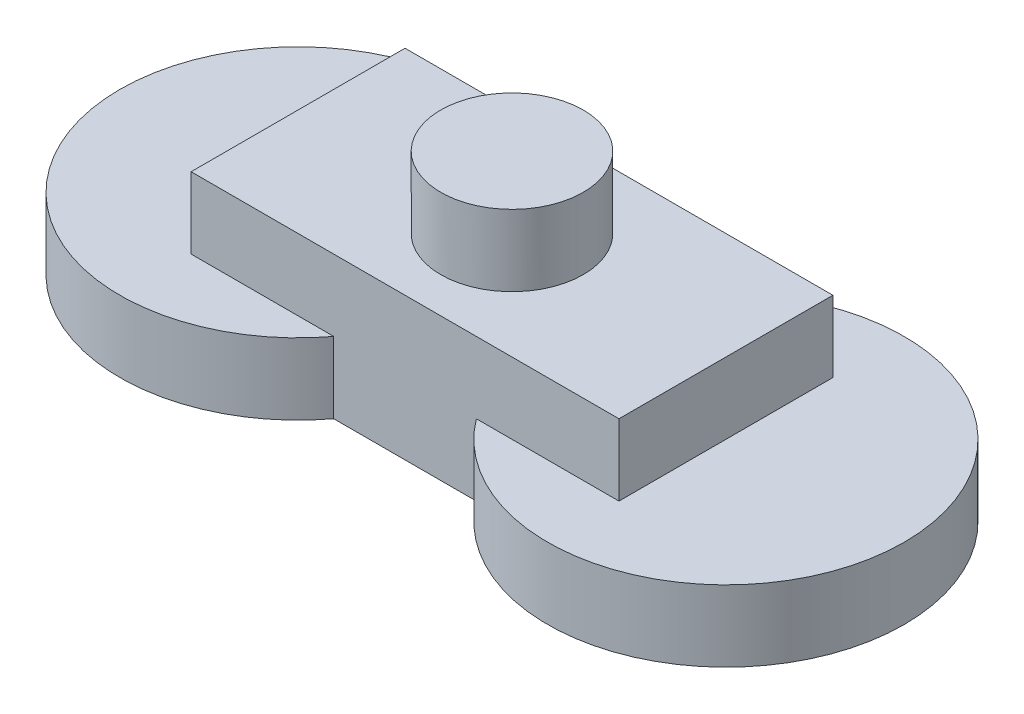
from build123d import *

# Parameters (mm, degrees)
EXTRUDE_1_DEPTH   = 10
EXTRUDE_1_2_DEPTH = 10
SKETCH_1_3_W      = 60
SKETCH_1_3_H      = 30
SKETCH_1_3_R      = 10
EXTRUDE_2_DEPTH   = 20
SKETCH_7_R        = 10
EXTRUDE_4_DEPTH   = 30


with BuildPart() as part:
    # 스케치1 → 보스-돌출1 (new body)
    with BuildSketch(Plane(origin=(0, 0, 0), x_dir=(1, 0, 0), z_dir=(0, 1, 0))):
        with BuildLine():
            Line((20.689216343, -8.628600134), (20.689216343, -38.628600134))
            Line((20.689216343, -38.628600134), (0.689216343, -38.628600134))
            ThreePointArc((0.689216343, -38.628600134), (45.689216343, -23.628600134), (0.689216343, -8.628600134))
            Line((0.689216343, -8.628600134), (20.689216343, -8.628600134))
        make_face()
    extrude(amount=EXTRUDE_1_DEPTH)



with BuildPart() as body_2:
    # 스케치1 → Extrude 1 2 (new body)
    with BuildSketch(Plane(origin=(0, 0, 0), x_dir=(1, 0, 0), z_dir=(0, 1, 0))):
        with BuildLine():
            ThreePointArc((-19.310783657, -8.628600134), (-64.310783657, -23.628600134), (-19.310783657, -38.628600134))
            Line((-19.310783657, -38.628600134), (-39.310783657, -38.628600134))
            Line((-39.310783657, -38.628600134), (-39.310783657, -8.628600134))
            Line((-39.310783657, -8.628600134), (-19.310783657, -8.628600134))
        make_face()
    extrude(amount=EXTRUDE_1_2_DEPTH)


with BuildPart() as part_1:
    add(part.part)

    add(body_2.part)  # 보스-돌출2 merges body 2
    # 스케치1<3> → 보스-돌출2 (add)
    with BuildSketch(Plane(origin=(0, 0, 0), x_dir=(1, 0, 0), z_dir=(0, 1, 0))):
        with Locations((-9.310783657, -23.628600134)):
            Rectangle(SKETCH_1_3_W, SKETCH_1_3_H)
        with Locations((-9.310783657, -23.628600134)):
            Circle(SKETCH_1_3_R, mode=Mode.SUBTRACT)
    extrude(amount=EXTRUDE_2_DEPTH)

    # 스케치7 → 보스-돌출4 (add)
    with BuildSketch(Plane.XZ):
        with Locations((-9.310783657, 23.628600134)):
            Circle(SKETCH_7_R)
    extrude(amount=-EXTRUDE_4_DEPTH)


solid = part_1.part
